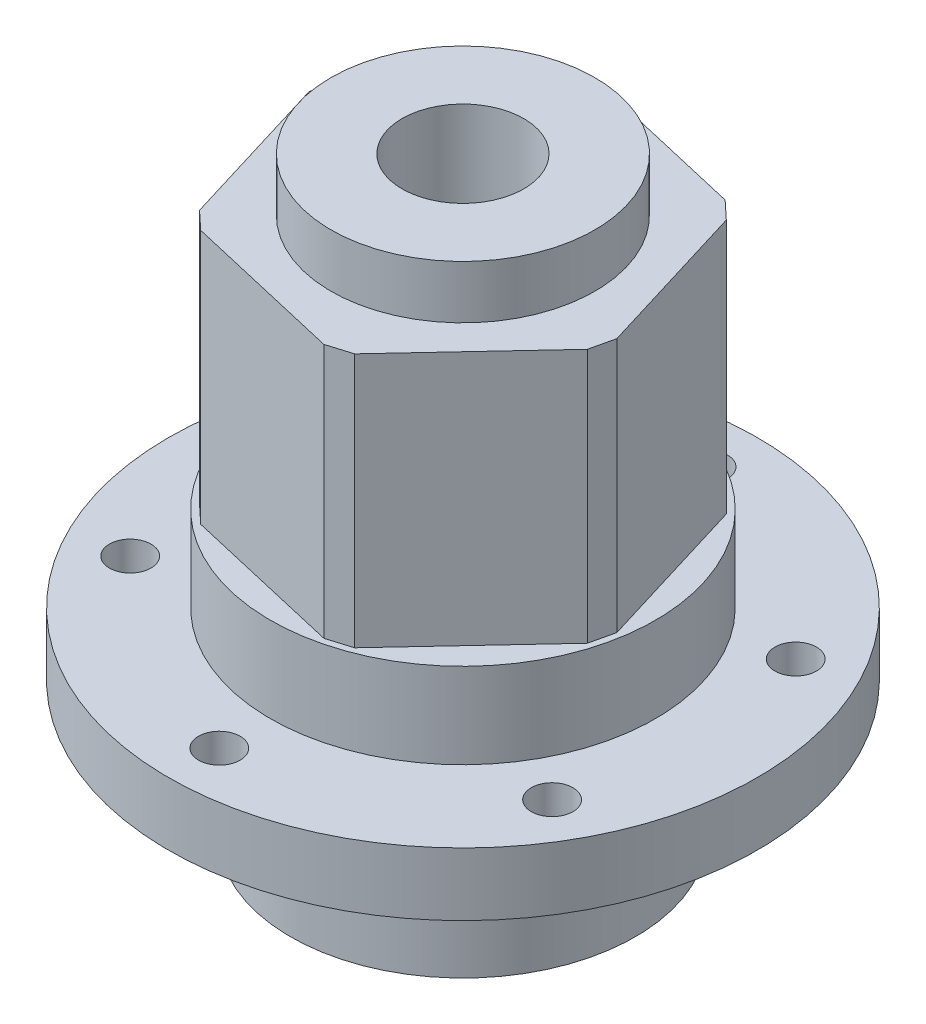
from build123d import *

# Parameters (mm, degrees)
ESTRUSIONE_ESTRUSIONE1_DEPTH = 12.54
SCHIZZO3_R                   = 6.5
ESTRUSIONE_ESTRUSIONE2_DEPTH = 2.62
SCHIZZO4_R                   = 3
TAGLIO_ESTRUSIONE1_DEPTH     = 36.652428389
FORO_FILETTATO_M2_5X0_45_1_D = 2.05


with BuildPart() as part:
    # Schizzo1 → Rivoluzione1 (revolve)
    with BuildSketch(Plane.XY, mode=Mode.PRIVATE) as rivoluzione1_sk:
        with BuildLine():
            Line((0, 0), (9.485, 0))
            Line((9.485, 0), (9.485, -4.2))
            Line((9.485, -4.2), (14.505, -4.2))
            Line((14.505, -4.2), (14.505, -7.3))
            Line((14.505, -7.3), (10.745, -7.3))
            ThreePointArc((10.745, -7.3), (9.154009742, -7.959009742), (8.495, -9.55))
            Line((8.495, -9.55), (8.495, -14))
            Line((8.495, -14), (0, -14))
            Line((0, -14), (0, 0))
        make_face()
    revolve(rivoluzione1_sk.sketch.rotate(Axis((0, 0, 0), (0, -1, 0)), 180), axis=Axis((0, 0, 0), (0, -1, 0)))

    # Schizzo2 → Estrusione-Estrusione1 (add)
    with BuildSketch(Plane(origin=(0, 0, 0), x_dir=(1, 0, 0), z_dir=(0, 1, 0))):
        Polygon((2.090015263, -8.937889289), (3.249793028, -8.584455371), (8.785446812, -2.658938333), (9.059252943, -1.477824366), (6.695431549, 6.278950956), (5.809459915, 7.106631005), (-2.090015263, 8.937889289), (-3.249793028, 8.584455371), (-8.785446812, 2.658938333), (-9.059252943, 1.477824366), (-6.695431549, -6.278950956), (-5.809459915, -7.106631005), align=None)
    extrude(amount=ESTRUSIONE_ESTRUSIONE1_DEPTH)

    # Schizzo3 → Estrusione-Estrusione2 (add)
    with BuildSketch(Plane(origin=(0, 12.54, 0), x_dir=(1, 0, 0), z_dir=(0, 1, 0))):
        with Locations(Location((0, 0, 0), (0, 0, 180))):
            Circle(SCHIZZO3_R)
    extrude(amount=ESTRUSIONE_ESTRUSIONE2_DEPTH)

    # Schizzo4 → Taglio-Estrusione1 (cut, through all)
    with BuildSketch(Plane(origin=(0, 15.16, 0), x_dir=(1, 0, 0), z_dir=(0, 1, 0))):
        with Locations(Location((0, 0, 0), (0, 0, 180))):
            Circle(SCHIZZO4_R)
    extrude(amount=-TAGLIO_ESTRUSIONE1_DEPTH, mode=Mode.SUBTRACT)

    # Foro filettato M2.5x0.45-1 (through all)
    with Locations(Plane(origin=(0, -4.2, 0), x_dir=(1, 0, 0), z_dir=(0, 1, 0))):
        with Locations((0, -12), (-10.392304845, -6), (-10.392304845, 6), (0, 12), (10.392304845, 6), (10.392304845, -6), (0, 0)):
            Hole(FORO_FILETTATO_M2_5X0_45_1_D / 2)


solid = part.part
